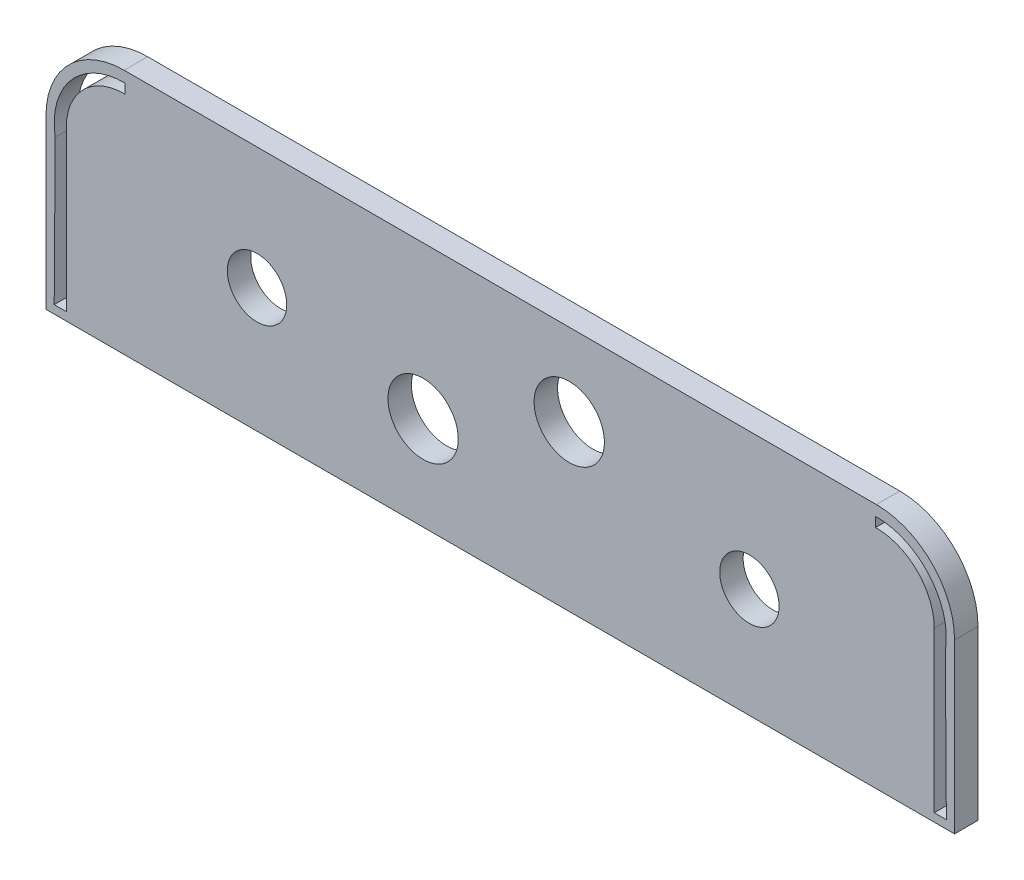
from build123d import *

# Parameters (mm, degrees)
SKETCH1_R           = 3.8
BOSS_EXTRUDE2_DEPTH = 3
SKETCH2_R           = 4.35
BOSS_EXTRUDE3_DEPTH = 25
CUT_EXTRUDE3_START  = -1
SKETCH10_R          = 4.35
CUT_EXTRUDE3_DEPTH  = 1
CUT_EXTRUDE4_DEPTH  = 50
SKETCH12_R          = 4.5
CUT_EXTRUDE6_DEPTH  = 50
CUT_EXTRUDE7_DEPTH  = 25


with BuildPart() as part:
    # Sketch1 → Boss-Extrude2 (new body)
    with BuildSketch(Plane.XY):
        with BuildLine():
            Line((-48.125, 15.75), (48.125, 15.75))
            ThreePointArc((48.125, 15.75), (55.196067812, 12.821067812), (58.125, 5.75))
            Line((58.125, 5.75), (58.125, -15.75))
            Line((58.125, -15.75), (-58.125, -15.75))
            Line((-58.125, -15.75), (-58.125, 5.75))
            ThreePointArc((-58.125, 5.75), (-55.196067812, 12.821067812), (-48.125, 15.75))
        make_face()
        with Locations((31.875, -1.75)):
            Circle(SKETCH1_R, mode=Mode.SUBTRACT)
        with Locations((-31.125, 0.15)):
            Circle(SKETCH1_R, mode=Mode.SUBTRACT)
    extrude(amount=BOSS_EXTRUDE2_DEPTH)

    # Sketch2 → Boss-Extrude3 (add)
    with BuildSketch(Plane.XY.offset(3)):
        with Locations((8.825, 5.25)):
            Circle(SKETCH2_R)
        with Locations((-9.875, -3.75)):
            Circle(SKETCH2_R)
        with BuildLine():
            Line((55.625, 5.75), (55.625, -15.75))
            Line((55.625, -15.75), (58.125, -15.75))
            Line((58.125, -15.75), (58.125, 5.25))
            Line((58.125, 5.25), (58.125, 5.75))
            ThreePointArc((58.125, 5.75), (55.196067812, 12.821067812), (48.125, 15.75))
            Line((48.125, 15.75), (48.125, 13.25))
            ThreePointArc((48.125, 13.25), (53.428300859, 11.053300859), (55.625, 5.75))
        make_face()
        with BuildLine():
            Line((-58.125, -15.75), (-55.625, -15.75))
            Line((-55.625, -15.75), (-55.625, 5.75))
            ThreePointArc((-55.625, 5.75), (-53.428300859, 11.053300859), (-48.125, 13.25))
            Line((-48.125, 13.25), (-48.125, 15.75))
            ThreePointArc((-48.125, 15.75), (-55.196067812, 12.821067812), (-58.125, 5.75))
            Line((-58.125, 5.75), (-58.125, 5.25))
            Line((-58.125, 5.25), (-58.125, -15.75))
        make_face()
    extrude(amount=BOSS_EXTRUDE3_DEPTH)

    # Sketch10 → Cut-Extrude3 (cut)
    with BuildSketch(Plane.XY.offset(28).offset(CUT_EXTRUDE3_START)):
        with Locations((8.825, 5.25)):
            Circle(SKETCH10_R)
        with Locations((-9.875, -3.75)):
            Circle(SKETCH10_R)
    extrude(amount=CUT_EXTRUDE3_DEPTH, mode=Mode.SUBTRACT)

    # Sketch5 → Cut-Extrude4 (cut)
    with BuildSketch(Plane.XY.offset(28)):
        with BuildLine():
            Line((55.525, -14.7), (55.525, 5.75))
            ThreePointArc((55.525, 5.75), (53.322114584, 11.017826876), (48.025, 13.149324293))
            Line((48.025, 13.149324293), (48.025, 14.384631142))
            ThreePointArc((48.025, 14.384631142), (54.933874825, 11.243952477), (56.946937757, 3.926576481))
            Line((56.946937757, 3.926576481), (57.075693637, -14.7))
            Line((57.075693637, -14.7), (55.525, -14.7))
        make_face()
        with BuildLine():
            Line((-56.946937757, 3.926576481), (-57.075693637, -14.7))
            Line((-57.075693637, -14.7), (-55.525, -14.7))
            Line((-55.525, -14.7), (-55.525, 5.75))
            ThreePointArc((-55.525, 5.75), (-53.322114584, 11.017826876), (-48.025, 13.149324293))
            Line((-48.025, 13.149324293), (-48.025, 14.384631142))
            ThreePointArc((-48.025, 14.384631142), (-54.933874825, 11.243952477), (-56.946937757, 3.926576481))
        make_face()
    extrude(amount=-CUT_EXTRUDE4_DEPTH, mode=Mode.SUBTRACT)

    # Sketch12 → Cut-Extrude6 (cut)
    with BuildSketch(Plane.XY.offset(27)):
        with Locations((-9.875, -3.75)):
            Circle(SKETCH12_R)
        with Locations((8.825, 5.25)):
            Circle(SKETCH12_R)
    extrude(amount=-CUT_EXTRUDE6_DEPTH, mode=Mode.SUBTRACT)

    # Sketch13 → Cut-Extrude7 (cut)
    with BuildSketch(Plane.XY.offset(28)):
        with BuildLine():
            Line((57.075693637, -14.7), (55.625, -14.7))
            Line((55.625, -14.7), (55.625, -15.75))
            Line((55.625, -15.75), (58.125, -15.75))
            Line((58.125, -15.75), (58.125, 5.75))
            ThreePointArc((58.125, 5.75), (55.196067812, 12.821067812), (48.125, 15.75))
            Line((48.125, 15.75), (48.125, 14.385189819))
            ThreePointArc((48.125, 14.385189819), (54.966220263, 11.205822827), (56.946937757, 3.926576481))
            Line((56.946937757, 3.926576481), (57.075693637, -14.7))
        make_face()
        with BuildLine():
            Line((-48.125, 14.385189819), (-48.125, 15.75))
            ThreePointArc((-48.125, 15.75), (-55.196067812, 12.821067812), (-58.125, 5.75))
            Line((-58.125, 5.75), (-58.125, -15.75))
            Line((-58.125, -15.75), (-55.625, -15.75))
            Line((-55.625, -15.75), (-55.625, -14.7))
            Line((-55.625, -14.7), (-57.075693637, -14.7))
            Line((-57.075693637, -14.7), (-56.946937757, 3.926576481))
            ThreePointArc((-56.946937757, 3.926576481), (-54.966220263, 11.205822827), (-48.125, 14.385189819))
        make_face()
    extrude(amount=-CUT_EXTRUDE7_DEPTH, mode=Mode.SUBTRACT)


solid = part.part
